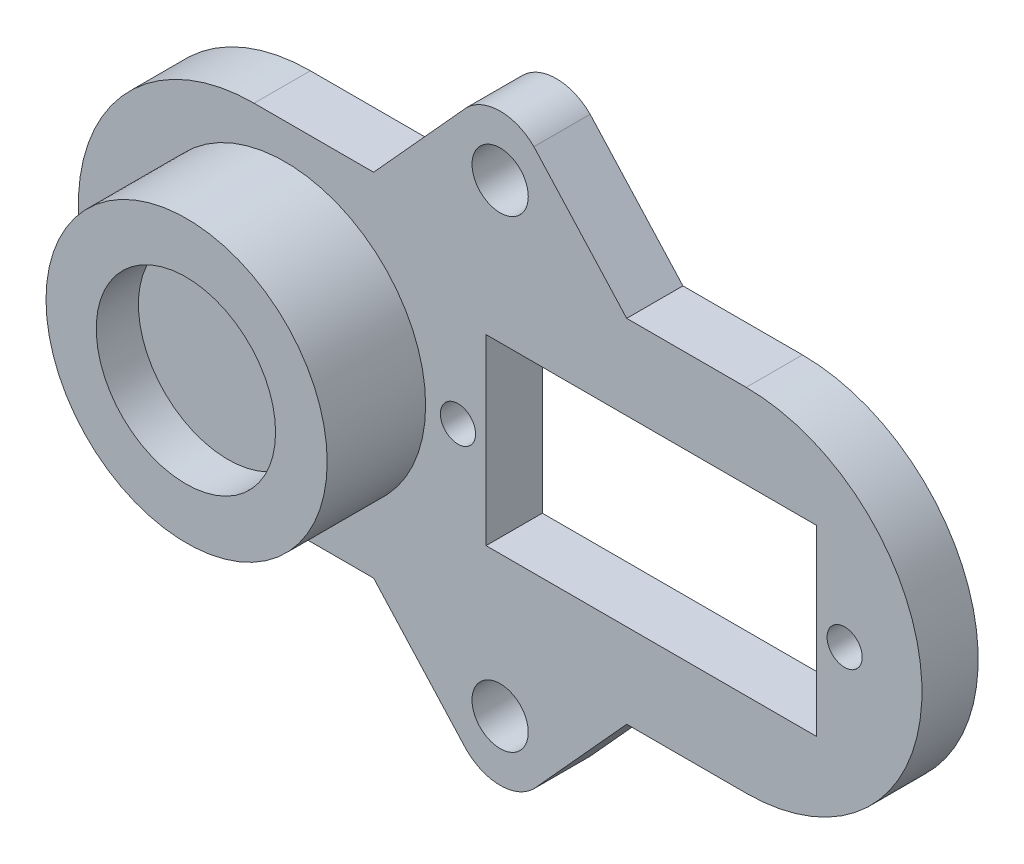
from build123d import *

# Parameters (mm, degrees)
SKETCH1_R           = 2
SKETCH1_R_2         = 1.25
SKETCH1_W           = 23.5
SKETCH1_H           = 13
BOSS_EXTRUDE1_DEPTH = 4
SKETCH3_R           = 10
BOSS_EXTRUDE2_DEPTH = 7
SKETCH4_R           = 6.377506195
CUT_EXTRUDE1_DEPTH  = 3


with BuildPart() as part:
    # Sketch1 → Boss-Extrude1 (new body)
    with BuildSketch(Plane.XY):
        with BuildLine():
            Line((-9, 12.5), (-2.401010284, 19.772380391))
            ThreePointArc((-2.401010284, 19.772380391), (0, 20.766911414), (2.401010284, 19.772380391))
            Line((2.401010284, 19.772380391), (9, 12.5))
            Line((9, 12.5), (17.5, 12.5))
            ThreePointArc((17.5, 12.5), (30, 0), (17.5, -12.5))
            Line((17.5, -12.5), (9, -12.5))
            Line((9, -12.5), (2.401010284, -19.772380391))
            ThreePointArc((2.401010284, -19.772380391), (0, -20.766911414), (-2.401010284, -19.772380391))
            Line((-2.401010284, -19.772380391), (-9, -12.5))
            Line((-9, -12.5), (-17.5, -12.5))
            ThreePointArc((-17.5, -12.5), (-30, 0), (-17.5, 12.5))
            Line((-17.5, 12.5), (-9, 12.5))
        make_face()
        with Locations((0, 16.5)):
            Circle(SKETCH1_R, mode=Mode.SUBTRACT)
        with Locations(Location((0, -16.5, 0), (0, 0, 180))):
            Circle(SKETCH1_R, mode=Mode.SUBTRACT)
        with Locations((-3, 0)):
            Circle(SKETCH1_R_2, mode=Mode.SUBTRACT)
        with Locations((24.5, 0)):
            Circle(SKETCH1_R_2, mode=Mode.SUBTRACT)
        with Locations((10.75, 0)):
            Rectangle(SKETCH1_W, SKETCH1_H, mode=Mode.SUBTRACT)
    extrude(amount=BOSS_EXTRUDE1_DEPTH)

    # Sketch3 → Boss-Extrude2 (add)
    with BuildSketch(Plane.XY.offset(4)):
        with Locations((-15.3, 0)):
            Circle(SKETCH3_R)
    extrude(amount=BOSS_EXTRUDE2_DEPTH)

    # Sketch4 → Cut-Extrude1 (cut)
    with BuildSketch(Plane.XY.offset(11)):
        with Locations((-15.35, 0)):
            Circle(SKETCH4_R)
    extrude(amount=-CUT_EXTRUDE1_DEPTH, mode=Mode.SUBTRACT)


solid = part.part
